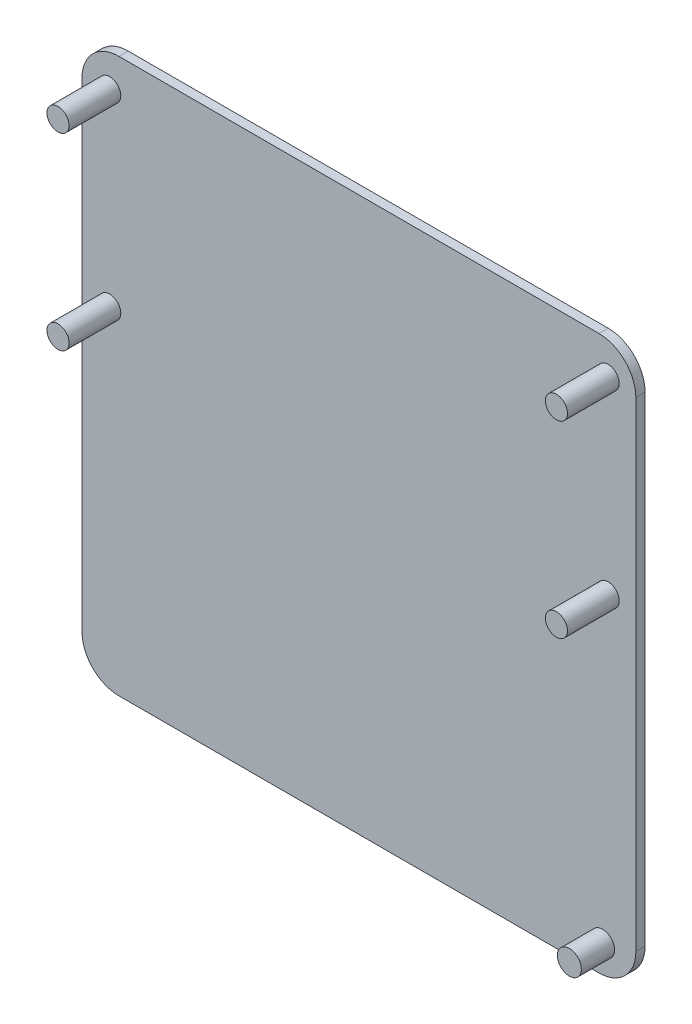
from build123d import *

# Parameters (mm, degrees)
BOSS_EXTRUDE1_DEPTH = 2.5
SKETCH3_R           = 3
BOSS_EXTRUDE2_DEPTH = 14
SKETCH4_R           = 3.25
BOSS_EXTRUDE3_DEPTH = 9


with BuildPart() as part:
    # Sketch2 → Boss-Extrude1 (new body)
    with BuildSketch(Plane.XY):
        with BuildLine():
            Line((-50.233491964, 44.055695146), (79.766508036, 44.055695146))
            ThreePointArc((79.766508036, 44.055695146), (86.837575848, 41.126762958), (89.766508036, 34.055695146))
            Line((89.766508036, 34.055695146), (89.766508036, -95.944304854))
            ThreePointArc((89.766508036, -95.944304854), (86.837575848, -103.015372665), (79.766508036, -105.944304854))
            Line((79.766508036, -105.944304854), (-50.233491964, -105.944304854))
            ThreePointArc((-50.233491964, -105.944304854), (-57.304559776, -103.015372665), (-60.233491964, -95.944304854))
            Line((-60.233491964, -95.944304854), (-60.233491964, 34.055695146))
            ThreePointArc((-60.233491964, 34.055695146), (-57.304559776, 41.126762958), (-50.233491964, 44.055695146))
        make_face()
    extrude(amount=BOSS_EXTRUDE1_DEPTH)

    # Sketch3 → Boss-Extrude2 (add)
    with BuildSketch(Plane.XY.offset(2.5)):
        with Locations((-52.733491964, 35.055695146)):
            Circle(SKETCH3_R)
        with Locations((-52.733491964, -15.944304854)):
            Circle(SKETCH3_R)
        with Locations((82.266508036, -15.944304854)):
            Circle(SKETCH3_R)
        with Locations((82.266508036, 35.055695146)):
            Circle(SKETCH3_R)
    extrude(amount=BOSS_EXTRUDE2_DEPTH)

    # Sketch4 → Boss-Extrude3 (add)
    with BuildSketch(Plane.XY.offset(2.5)):
        with Locations((80.766508036, -98.444304854)):
            Circle(SKETCH4_R)
    extrude(amount=BOSS_EXTRUDE3_DEPTH)


solid = part.part
